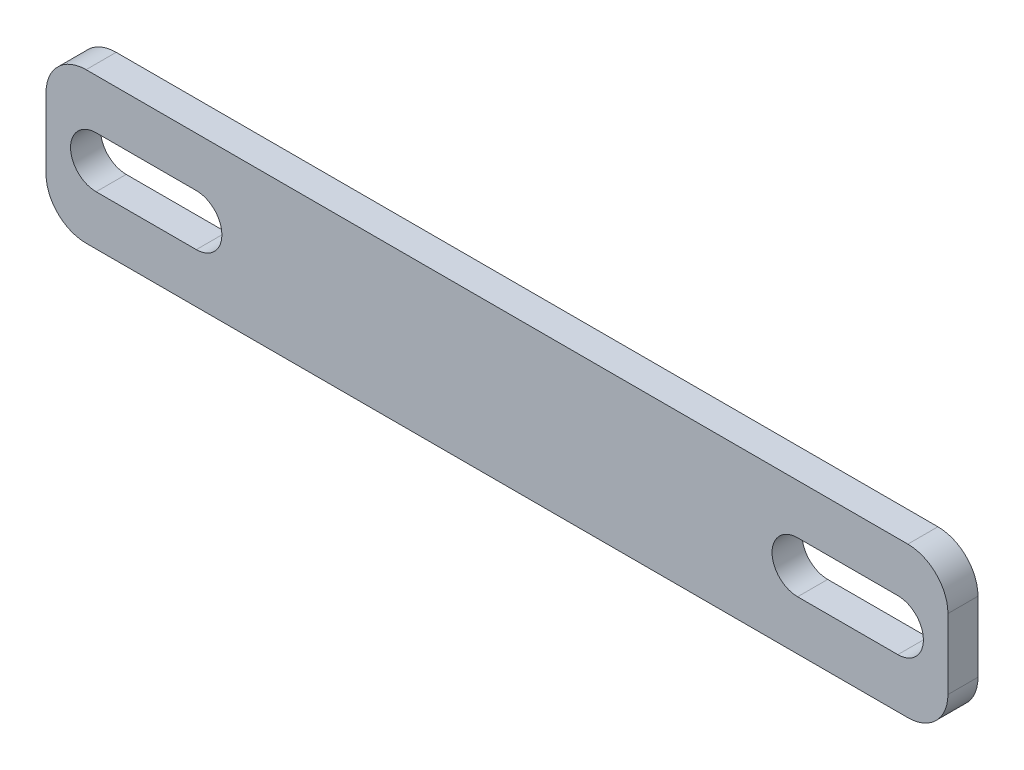
from build123d import *

# Parameters (mm, degrees)
AUFSATZ_LINEAR_AUSTRAGEN1_DEPTH = 3


with BuildPart() as part:
    # Model → Aufsatz-Linear austragen1 (new body)
    with BuildSketch(Plane.XY):
        with BuildLine():
            Line((4, 0), (86, 0))
            ThreePointArc((86, 0), (88.828427125, 1.171572875), (90, 4))
            Line((90, 4), (90, 11))
            ThreePointArc((90, 11), (88.828427125, 13.828427125), (86, 15))
            Line((86, 15), (4, 15))
            ThreePointArc((4, 15), (1.171572875, 13.828427125), (0, 11))
            Line((0, 11), (0, 4))
            ThreePointArc((0, 4), (1.171572875, 1.171572875), (4, 0))
        make_face()
        with BuildLine():
            Line((5, 4.95), (15, 4.95))
            ThreePointArc((15, 4.95), (17.55, 7.5), (15, 10.05))
            Line((15, 10.05), (5, 10.05))
            ThreePointArc((5, 10.05), (2.45, 7.5), (5, 4.95))
        make_face(mode=Mode.SUBTRACT)
        with BuildLine():
            Line((75, 4.95), (85, 4.95))
            ThreePointArc((85, 4.95), (87.55, 7.5), (85, 10.05))
            Line((85, 10.05), (75, 10.05))
            ThreePointArc((75, 10.05), (72.45, 7.5), (75, 4.95))
        make_face(mode=Mode.SUBTRACT)
    extrude(amount=AUFSATZ_LINEAR_AUSTRAGEN1_DEPTH)


solid = part.part
